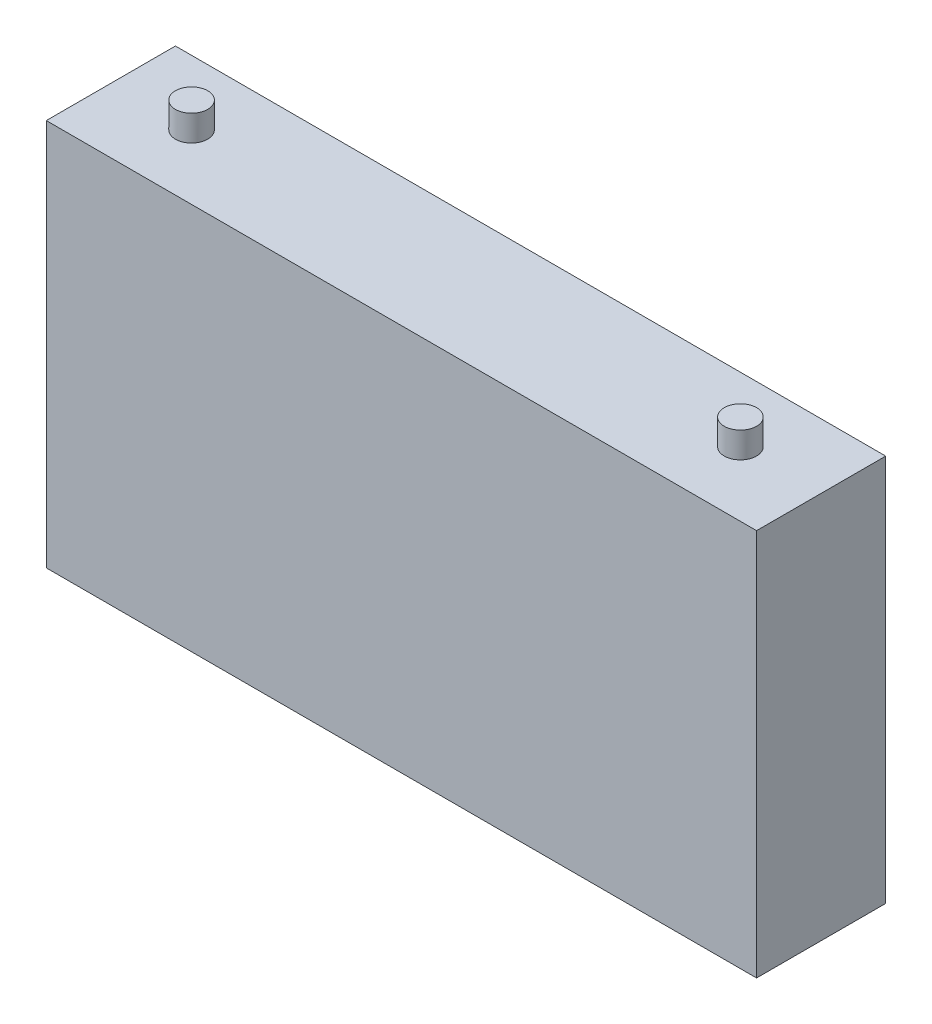
from build123d import *

# Parameters (mm, degrees)
SKETCH_1_W      = 220
SKETCH_1_H      = 120
EXTRUDE_1_DEPTH = 20
EXTRUDE_START   = 60
SKETCH_2_R      = 5
EXTRUDE_2_DEPTH = 8
EXTRUDE_START_2 = -68
SKETCH_3_R      = 5
EXTRUDE_3_DEPTH = 8


with BuildPart() as part:
    # ｽｹｯﾁ1 → ﾎﾞｽ - 押し出し1 (new, symmetric)
    with BuildSketch(Plane.XY):
        Rectangle(SKETCH_1_W, SKETCH_1_H)
    extrude(amount=EXTRUDE_1_DEPTH, both=True)

    # ｽｹｯﾁ2 → ﾎﾞｽ - 押し出し2 (add)
    with BuildSketch(Plane(origin=(0, 0, 0), x_dir=(1, 0, 0), z_dir=(0, 1, 0)).offset(EXTRUDE_START)):
        with Locations(Location((85, 0, 0), (0, 0, 90))):
            Circle(SKETCH_2_R)
        with Locations(Location((-85, 0, 0), (0, 0, 90))):
            Circle(SKETCH_2_R)
    extrude(amount=EXTRUDE_2_DEPTH)

    # ｽｹｯﾁ3 → ﾎﾞｽ - 押し出し3 (add)
    with BuildSketch(Plane(origin=(0, 0, 0), x_dir=(1, 0, 0), z_dir=(0, 1, 0)).offset(EXTRUDE_START_2)):
        with Locations(Location((85, 0, 0), (0, 0, 90))):
            Circle(SKETCH_3_R)
        with Locations(Location((-85, 0, 0), (0, 0, 90))):
            Circle(SKETCH_3_R)
    extrude(amount=EXTRUDE_3_DEPTH)


solid = part.part
